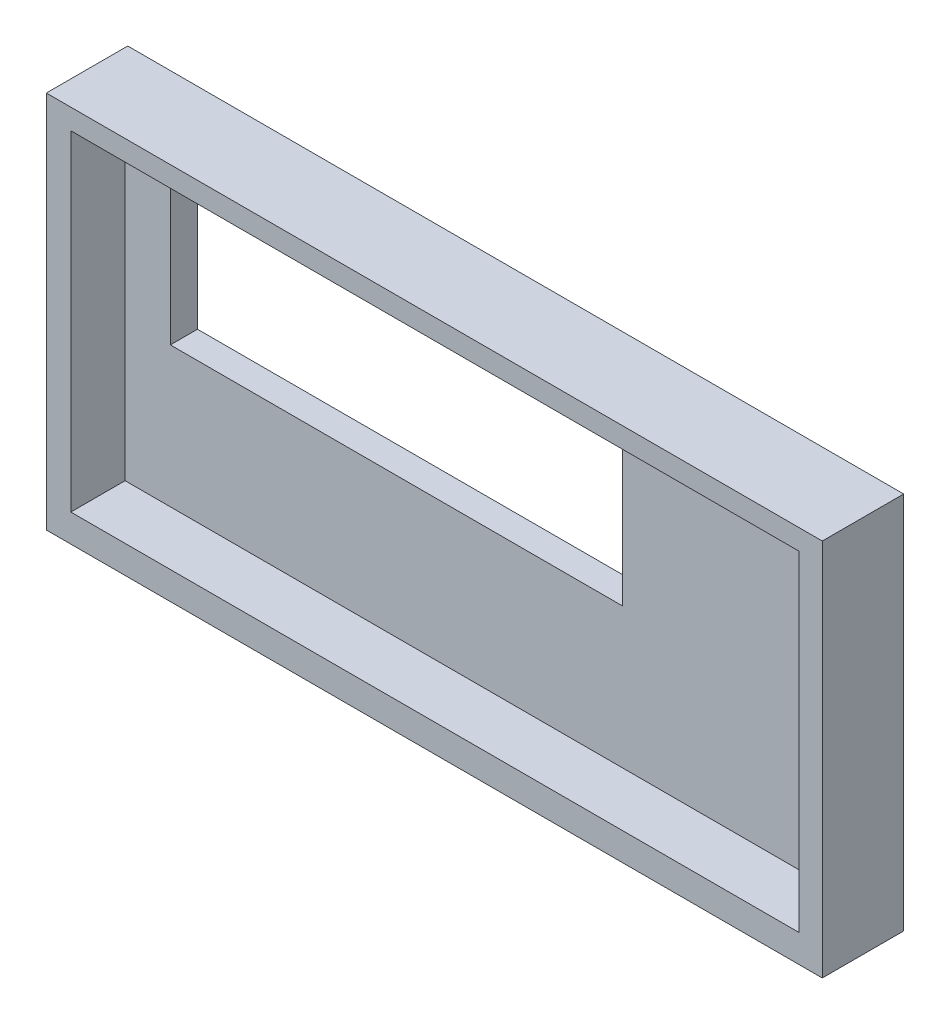
from build123d import *

# Parameters (mm, degrees)
SKETCH2_W           = 85.76635514
SKETCH2_H           = 41.829906542
SKETCH2_W_2         = 80.5
SKETCH2_H_2         = 36.5
BOSS_EXTRUDE1_DEPTH = 6
SKETCH4_W           = 85.76635514
SKETCH4_H           = 41.829906542
BOSS_EXTRUDE2_DEPTH = 3
SKETCH6_W           = 50
SKETCH6_H           = 21
CUT_EXTRUDE1_DEPTH  = 10


with BuildPart() as part:
    # Sketch2 → Boss-Extrude1 (new body)
    with BuildSketch(Plane.XY):
        with Locations((5.943457944, 7.071962617)):
            Rectangle(SKETCH2_W, SKETCH2_H)
        with Locations((6.018691589, 7.479906542)):
            Rectangle(SKETCH2_W_2, SKETCH2_H_2, mode=Mode.SUBTRACT)
    extrude(amount=BOSS_EXTRUDE1_DEPTH)

    # Sketch4 → Boss-Extrude2 (add)
    with BuildSketch(Plane(origin=(0, 0, 0), x_dir=(-1, 0, 0), z_dir=(0, 0, -1))):
        with Locations((-5.943457944, 7.071962617)):
            Rectangle(SKETCH4_W, SKETCH4_H)
    extrude(amount=BOSS_EXTRUDE2_DEPTH)

    # Sketch6 → Cut-Extrude1 (cut)
    with BuildSketch(Plane.XY):
        with Locations((-4.231308411, 15.229906542)):
            Rectangle(SKETCH6_W, SKETCH6_H)
    extrude(amount=-CUT_EXTRUDE1_DEPTH, mode=Mode.SUBTRACT)


solid = part.part
